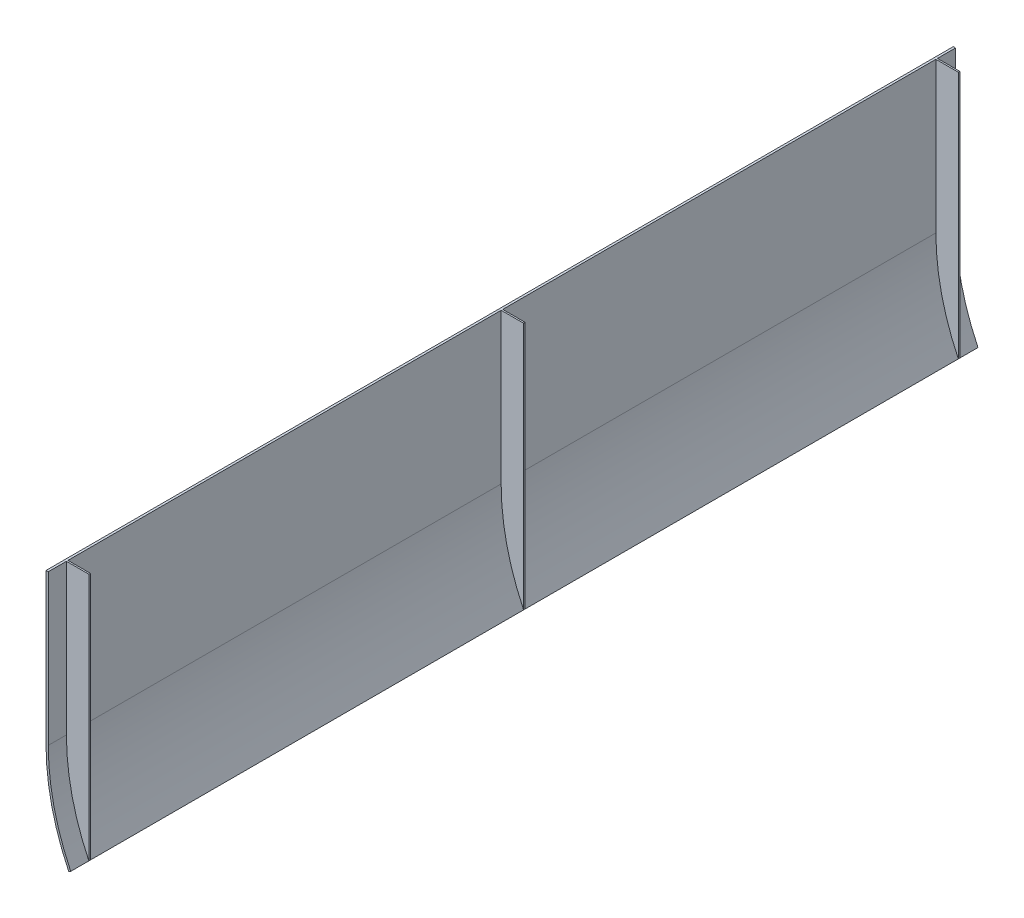
from build123d import *

# Parameters (mm, degrees)
SURFACE_EXTRUDE1_1_DEPTH = 1200
THICKEN1_T1              = 3
BOSS_EXTRUDE1_REACH      = 1246.822
SKETCH2_W                = 29.7
SKETCH2_H                = 2


with BuildPart() as body_1:
    # Surface-Extrude1: a surface, the sketch's curves swept straight by 1200 mm
    with BuildLine(Plane.XY, mode=Mode.PRIVATE) as surface_extrude1_1_path:
        Line((-30, 329.67), (-30, 130.766968306))
        ThreePointArc((-30, 130.766968306), (-22.403830344, 63.684928981), (0, 0))
    surface_extrude1_1 = Shell.extrude(surface_extrude1_1_path.wire(), (0 * SURFACE_EXTRUDE1_1_DEPTH, 0 * SURFACE_EXTRUDE1_1_DEPTH, 1 * SURFACE_EXTRUDE1_1_DEPTH))
    add(Solid.thicken(surface_extrude1_1, THICKEN1_T1))

    # Sketch2 → Boss-Extrude1 (add, up to next)
    with BuildSketch(Plane(origin=(0, 329.67, 0), x_dir=(1, 0, 0), z_dir=(0, 1, 0)), mode=Mode.PRIVATE) as boss_extrude1_sk1:
        with Locations((-12.15, -1175)):
            Rectangle(SKETCH2_W, SKETCH2_H)
    boss_extrude1_tool1 = extrude(boss_extrude1_sk1.sketch, amount=-BOSS_EXTRUDE1_REACH, mode=Mode.PRIVATE) - body_1.part
    # Sketch2 → Boss-Extrude1 (add, up to next)
    with BuildSketch(Plane(origin=(0, 329.67, 0), x_dir=(1, 0, 0), z_dir=(0, 1, 0)), mode=Mode.PRIVATE) as boss_extrude1_sk2:
        with Locations((-12.15, -600)):
            Rectangle(SKETCH2_W, SKETCH2_H)
    boss_extrude1_tool2 = extrude(boss_extrude1_sk2.sketch, amount=-BOSS_EXTRUDE1_REACH, mode=Mode.PRIVATE) - body_1.part
    # Sketch2 → Boss-Extrude1 (add, up to next)
    with BuildSketch(Plane(origin=(0, 329.67, 0), x_dir=(1, 0, 0), z_dir=(0, 1, 0)), mode=Mode.PRIVATE) as boss_extrude1_sk3:
        with Locations((-12.15, -25)):
            Rectangle(SKETCH2_W, SKETCH2_H)
    boss_extrude1_tool3 = extrude(boss_extrude1_sk3.sketch, amount=-BOSS_EXTRUDE1_REACH, mode=Mode.PRIVATE) - body_1.part
    add(boss_extrude1_tool1.solids().sort_by_distance((-12.15, 329.67, 1175))[0])
    add(boss_extrude1_tool2.solids().sort_by_distance((-12.15, 329.67, 600))[0])
    add(boss_extrude1_tool3.solids().sort_by_distance((-12.15, 329.67, 25))[0])


solid = body_1.part
